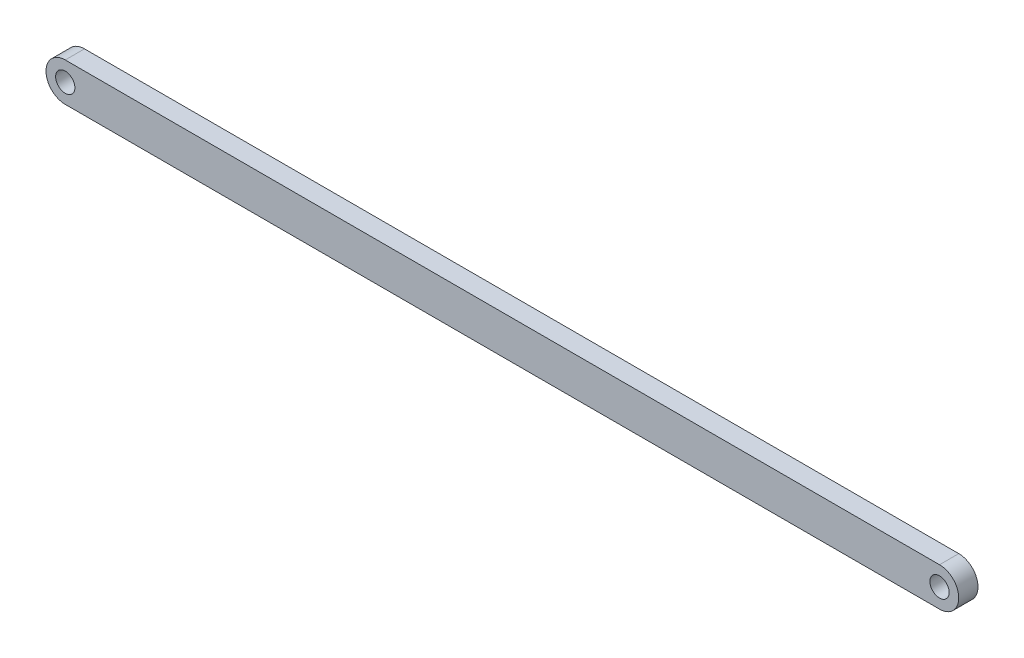
from build123d import *

# Parameters (mm, degrees)
ESBO_O1_R                = 2.5
RESSALTO_EXTRUS_O1_DEPTH = 5


with BuildPart() as part:
    # Esboço1 → Ressalto-extrusão1 (new body)
    with BuildSketch(Plane.XY):
        with BuildLine():
            Line((-113.59, 5), (113.59, 5))
            ThreePointArc((113.59, 5), (118.59, 0), (113.59, -5))
            Line((113.59, -5), (-113.59, -5))
            ThreePointArc((-113.59, -5), (-118.59, 0), (-113.59, 5))
        make_face()
        with Locations((113.59, 0)):
            Circle(ESBO_O1_R, mode=Mode.SUBTRACT)
        with Locations((-113.59, 0)):
            Circle(ESBO_O1_R, mode=Mode.SUBTRACT)
    extrude(amount=RESSALTO_EXTRUS_O1_DEPTH)


solid = part.part
